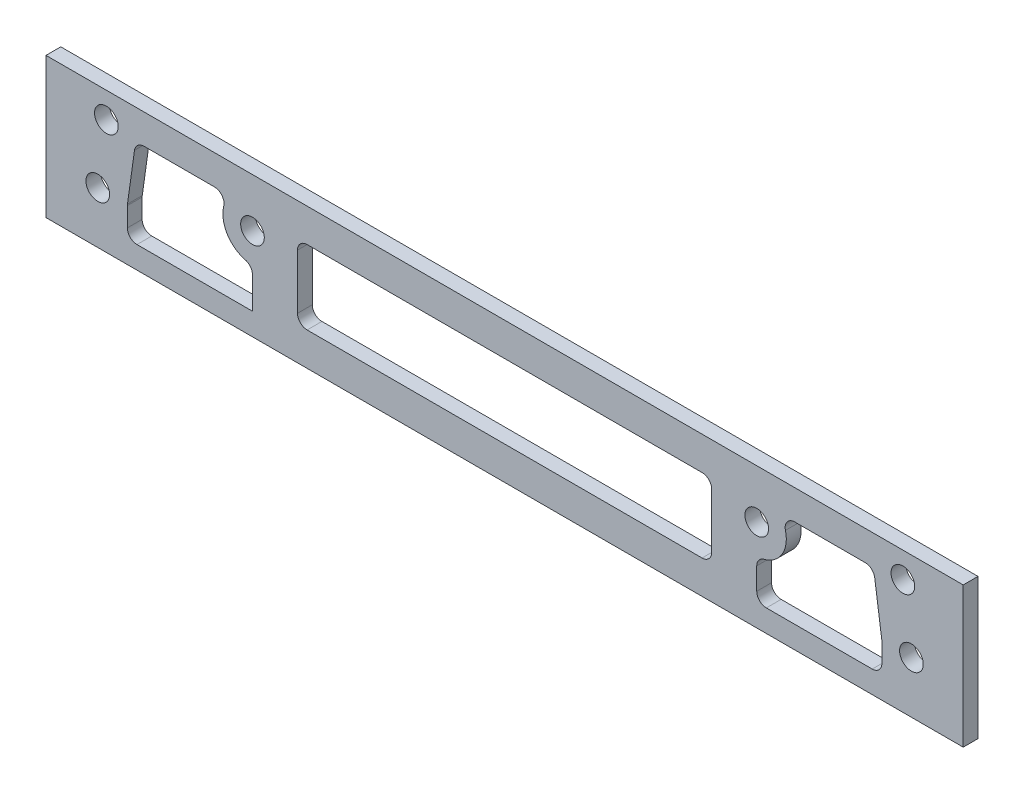
from build123d import *

# Parameters (mm, degrees)
SKETCH_1_W          = 124
SKETCH_1_H          = 19
EXTRUDE_1_DEPTH     = 2
SKETCH_3_R          = 1.6
CUT_EXTRUDE_2_DEPTH = 63.755477849
SKETCH_4_R          = 1.6
CUT_EXTRUDE_3_DEPTH = 63.755477849
SKETCH_5_W          = 56
SKETCH_5_H          = 10
CUT_EXTRUDE_4_DEPTH = 63.755477849
FILLET_1_R          = 1.3


with BuildPart() as part:
    # 草图1 → 凸台-拉伸1 (new body)
    with BuildSketch(Plane.XY):
        Rectangle(SKETCH_1_W, SKETCH_1_H)
    extrude(amount=EXTRUDE_1_DEPTH)

    # 草图3 → 切除-拉伸2 (cut, through all)
    with BuildSketch(Plane.XY.offset(2)):
        with Locations((-55, -2.5)):
            Circle(SKETCH_3_R)
        with Locations(Location((55, -2.5, 0), (0, 0, 180))):
            Circle(SKETCH_3_R)
    extrude(amount=-CUT_EXTRUDE_2_DEPTH, mode=Mode.SUBTRACT)

    # 草图4 → 切除-拉伸3 (cut, through all)
    with BuildSketch(Plane.XY.offset(2)):
        with Locations((-53.84, 6.04)):
            Circle(SKETCH_4_R)
        with Locations((-34.086233188, 2.911310699)):
            Circle(SKETCH_4_R)
        with Locations(Location((34.086233188, 2.911310699, 0), (0, 0, 180))):
            Circle(SKETCH_4_R)
        with Locations(Location((53.84, 6.04, 0), (0, 0, 180))):
            Circle(SKETCH_4_R)
    extrude(amount=-CUT_EXTRUDE_3_DEPTH, mode=Mode.SUBTRACT)

    # 草图5 → 切除-拉伸4 (cut, through all)
    with BuildSketch(Plane.XY.offset(2)):
        with BuildLine():
            Line((-49.87886563, 5.483749603), (-51, -2.5))
            Line((-51, -2.5), (-51, -6.5))
            Line((-51, -6.5), (-34.086233188, -6.5))
            Line((-34.086233188, -6.5), (-34.086233188, -1.088689301))
            ThreePointArc((-34.086233188, -1.088689301), (-37.711819735, 1.221600016), (-37.149329348, 5.483749603))
            Line((-37.149329348, 5.483749603), (-49.87886563, 5.483749603))
        make_face()
        Rectangle(SKETCH_5_W, SKETCH_5_H)
        with BuildLine():
            Line((34.086233188, -1.088689301), (34.086233188, -6.5))
            Line((34.086233188, -6.5), (51, -6.5))
            Line((51, -6.5), (51, -2.5))
            Line((51, -2.5), (49.87886563, 5.483749603))
            Line((49.87886563, 5.483749603), (37.149329348, 5.483749603))
            ThreePointArc((37.149329348, 5.483749603), (37.844715903, 4.28018165), (38.086233188, 2.911310699))
            ThreePointArc((38.086233188, 2.911310699), (36.914660313, 0.082883574), (34.086233188, -1.088689301))
        make_face()
    extrude(amount=-CUT_EXTRUDE_4_DEPTH, mode=Mode.SUBTRACT)

    # 圆角1
    fillet_1_edges = [part.edges().sort_by_distance(p)[0] for p in [
        (-37.149329348, 5.483749603, 1),
        (-34.086233188, -1.088689301, 1),
        (-51, -6.5, 1),
        (-51, -2.5, 1),
        (-49.87886563, 5.483749603, 1),
        (-28, -5, 1),
        (-28, 5, 1),
        (28, 5, 1),
        (28, -5, 1),
        (37.149329348, 5.483749603, 1),
        (49.87886563, 5.483749603, 1),
        (51, -2.5, 1),
        (51, -6.5, 1),
        (34.086233188, -6.5, 1),
        (34.086233188, -1.088689301, 1),
    ]]
    fillet(fillet_1_edges, radius=FILLET_1_R)


solid = part.part
